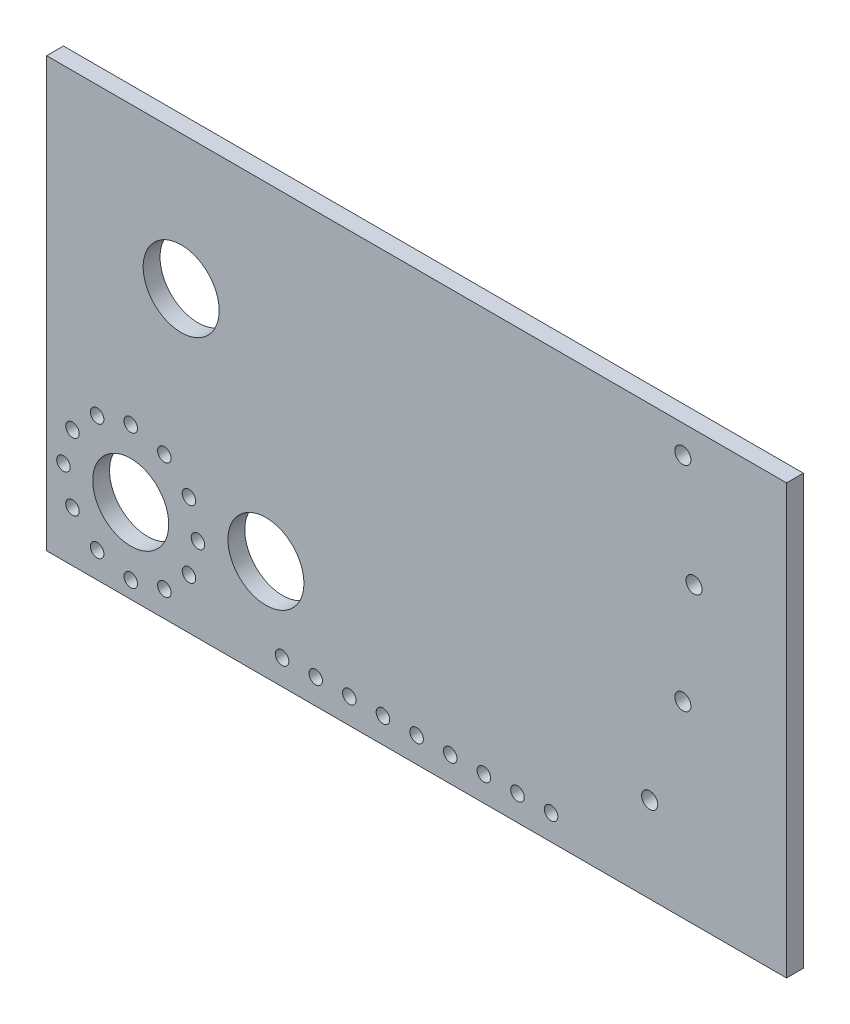
from build123d import *

# Parameters (mm, degrees)
SKETCH1_R           = 2.5527
SKETCH1_R_2         = 3.048
SKETCH1_R_3         = 14.351
BOSS_EXTRUDE1_DEPTH = 6.35


with BuildPart() as part:
    # Sketch1 → Boss-Extrude1 (new body)
    with BuildSketch(Plane.XY):
        Polygon((0, -9.525), (-139.7, -9.525), (-139.7, 152.4), (139.7, 152.4), (139.7, -9.525), align=None)
        Circle(SKETCH1_R, mode=Mode.SUBTRACT)
        with Locations((12.7, 0)):
            Circle(SKETCH1_R, mode=Mode.SUBTRACT)
        with Locations((25.4, 0)):
            Circle(SKETCH1_R, mode=Mode.SUBTRACT)
        with Locations((38.1, 0)):
            Circle(SKETCH1_R, mode=Mode.SUBTRACT)
        with Locations((50.8, 0)):
            Circle(SKETCH1_R, mode=Mode.SUBTRACT)
        with Locations(Location((-50.8, 0, 0), (0, 0, 180))):
            Circle(SKETCH1_R, mode=Mode.SUBTRACT)
        with Locations(Location((-38.1, 0, 0), (0, 0, 180))):
            Circle(SKETCH1_R, mode=Mode.SUBTRACT)
        with Locations(Location((-25.4, 0, 0), (0, 0, 180))):
            Circle(SKETCH1_R, mode=Mode.SUBTRACT)
        with Locations(Location((-12.7, 0, 0), (0, 0, 180))):
            Circle(SKETCH1_R, mode=Mode.SUBTRACT)
        with Locations((-82.55, 22.225)):
            Circle(SKETCH1_R, mode=Mode.SUBTRACT)
        with Locations((-85.952954744, 9.525)):
            Circle(SKETCH1_R, mode=Mode.SUBTRACT)
        with Locations((-95.25, 0.227954744)):
            Circle(SKETCH1_R, mode=Mode.SUBTRACT)
        with Locations((-107.95, -3.175)):
            Circle(SKETCH1_R, mode=Mode.SUBTRACT)
        with Locations((-120.65, 0.227954744)):
            Circle(SKETCH1_R, mode=Mode.SUBTRACT)
        with Locations((-129.947045256, 9.525)):
            Circle(SKETCH1_R, mode=Mode.SUBTRACT)
        with Locations((-133.35, 22.225)):
            Circle(SKETCH1_R, mode=Mode.SUBTRACT)
        with Locations((-129.947045256, 34.925)):
            Circle(SKETCH1_R, mode=Mode.SUBTRACT)
        with Locations((-120.65, 44.222045256)):
            Circle(SKETCH1_R, mode=Mode.SUBTRACT)
        with Locations((-107.95, 47.625)):
            Circle(SKETCH1_R, mode=Mode.SUBTRACT)
        with Locations((-95.25, 44.222045256)):
            Circle(SKETCH1_R, mode=Mode.SUBTRACT)
        with Locations((-85.952954744, 34.925)):
            Circle(SKETCH1_R, mode=Mode.SUBTRACT)
        with Locations((100.542736572, 141.867296719)):
            Circle(SKETCH1_R_2, mode=Mode.SUBTRACT)
        with Locations((104.775, 101.6)):
            Circle(SKETCH1_R_2, mode=Mode.SUBTRACT)
        with Locations((100.542736572, 61.332703281)):
            Circle(SKETCH1_R_2, mode=Mode.SUBTRACT)
        with Locations((88.030916509, 22.825280652)):
            Circle(SKETCH1_R_2, mode=Mode.SUBTRACT)
        with Locations((-107.95, 22.225)):
            Circle(SKETCH1_R_3, mode=Mode.SUBTRACT)
        with Locations((-88.9, 101.6)):
            Circle(SKETCH1_R_3, mode=Mode.SUBTRACT)
        with Locations((-56.893674009, 28.423794002)):
            Circle(SKETCH1_R_3, mode=Mode.SUBTRACT)
    extrude(amount=BOSS_EXTRUDE1_DEPTH)


solid = part.part
